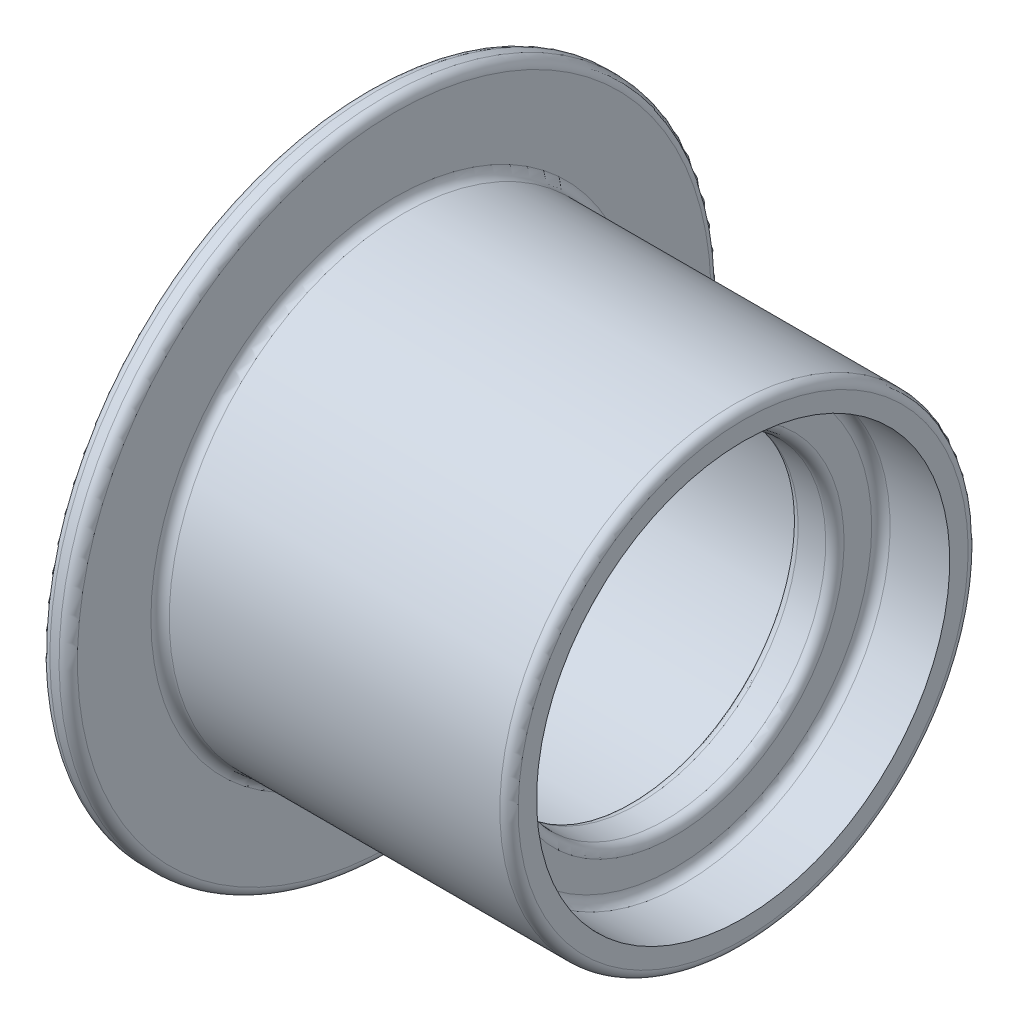
from build123d import *


with BuildPart() as part:
    # Sketch2 → Revolve1 (revolve)
    with BuildSketch(Plane.XY):
        with BuildLine():
            Line((1, 0), (37, 0))
            ThreePointArc((37, 0), (37.707106781, -0.292893219), (38, -1))
            Line((38, -1), (38, -3))
            Line((38, -3), (31.5, -3))
            ThreePointArc((31.5, -3), (30.792893219, -3.292893219), (30.5, -4))
            Line((30.5, -4), (30.5, -7.007306818))
            ThreePointArc((30.5, -7.007306818), (30.207106781, -7.714413599), (29.5, -8.007306818))
            Line((29.5, -8.007306818), (26.5, -8.007306818))
            ThreePointArc((26.5, -8.007306818), (25.792893219, -7.714413599), (25.5, -7.007306818))
            Line((25.5, -7.007306818), (25.5, -6.507306818))
            ThreePointArc((25.5, -6.507306818), (25.207106781, -5.800200037), (24.5, -5.507306818))
            Line((24.5, -5.507306818), (8, -5.507306818))
            ThreePointArc((8, -5.507306818), (7.292893219, -5.214413599), (7, -4.507306818))
            Line((7, -4.507306818), (7, -4))
            ThreePointArc((7, -4), (6.707106781, -3.292893219), (6, -3))
            Line((6, -3), (-2, -3))
            ThreePointArc((-2, -3), (-2.707106781, -2.707106781), (-3, -2))
            Line((-3, -2), (-3, 9))
            ThreePointArc((-3, 9), (-2.707106781, 9.707106781), (-2, 10))
            Line((-2, 10), (-1, 10))
            ThreePointArc((-1, 10), (-0.292893219, 9.707106781), (0, 9))
            Line((0, 9), (0, 1))
            ThreePointArc((0, 1), (0.292893219, 0.292893219), (1, 0))
        make_face()
    revolve(axis=Axis((7, -25.5, 0), (-1, 0, 0)))


solid = part.part
